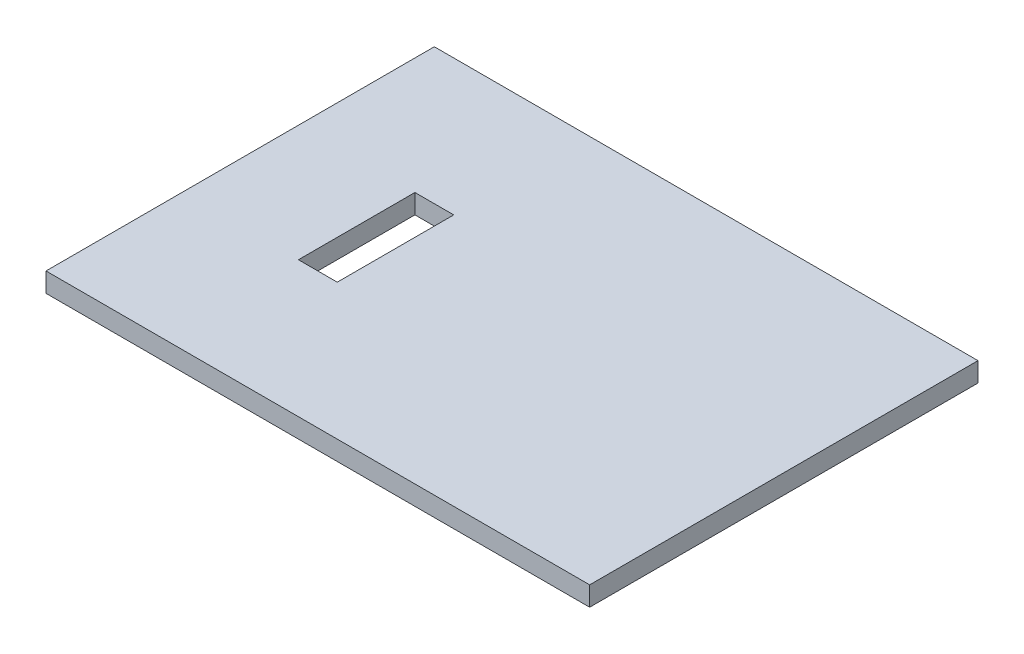
from build123d import *

# Parameters (mm, degrees)
SKETCH1_W           = 70
SKETCH1_H           = 50
BOSS_EXTRUDE1_DEPTH = 2.5
SKETCH2_W           = 5
SKETCH2_H           = 15
CUT_EXTRUDE1_DEPTH  = 2.5


with BuildPart() as part:
    # Sketch1 → Boss-Extrude1 (new body)
    with BuildSketch(Plane(origin=(0, 0, 0), x_dir=(1, 0, 0), z_dir=(0, 1, 0))):
        Rectangle(SKETCH1_W, SKETCH1_H)
    extrude(amount=BOSS_EXTRUDE1_DEPTH)

    # Sketch2 → Cut-Extrude1 (cut)
    with BuildSketch(Plane(origin=(0, 2.5, 0), x_dir=(1, 0, 0), z_dir=(0, 1, 0))):
        with Locations((-17.5, 0)):
            Rectangle(SKETCH2_W, SKETCH2_H)
    extrude(amount=-CUT_EXTRUDE1_DEPTH, mode=Mode.SUBTRACT)


solid = part.part
